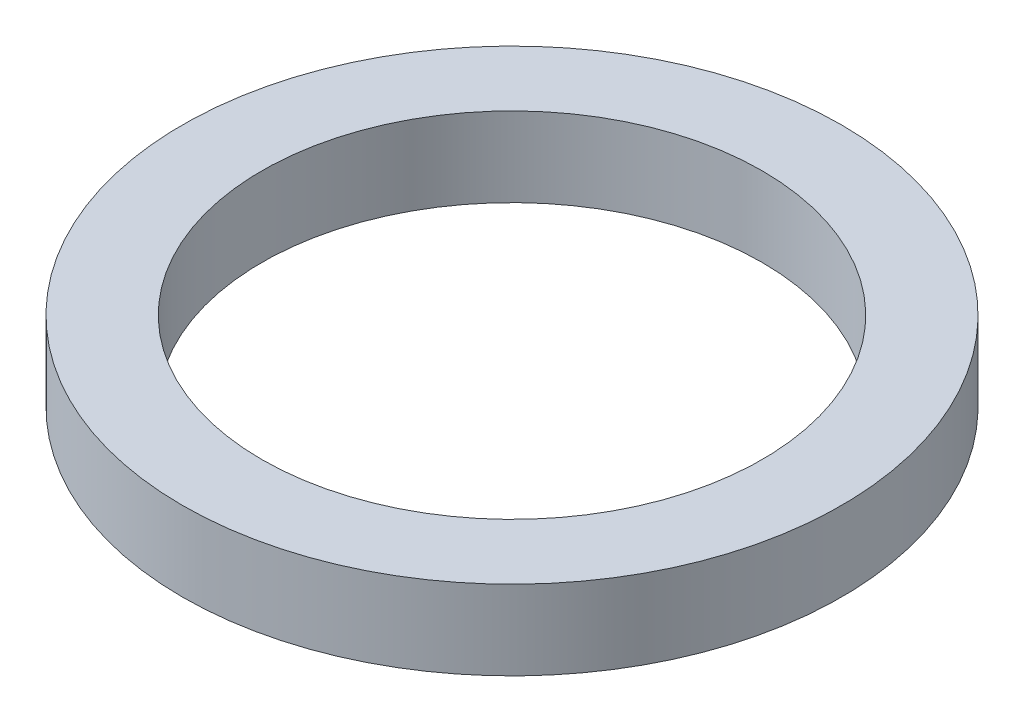
from build123d import *

# Parameters (mm, degrees)
SKETCH1_R           = 5.27
SKETCH1_R_2         = 4
BOSS_EXTRUDE1_DEPTH = 1.27


with BuildPart() as part:
    # Sketch1 → Boss-Extrude1 (new body)
    with BuildSketch(Plane(origin=(0, 0, 0), x_dir=(1, 0, 0), z_dir=(0, 1, 0))):
        with Locations(Location((0, 0, 0), (0, 0, 270))):
            Circle(SKETCH1_R)
        with Locations(Location((0, 0, 0), (0, 0, 270))):
            Circle(SKETCH1_R_2, mode=Mode.SUBTRACT)
    extrude(amount=BOSS_EXTRUDE1_DEPTH)


solid = part.part
